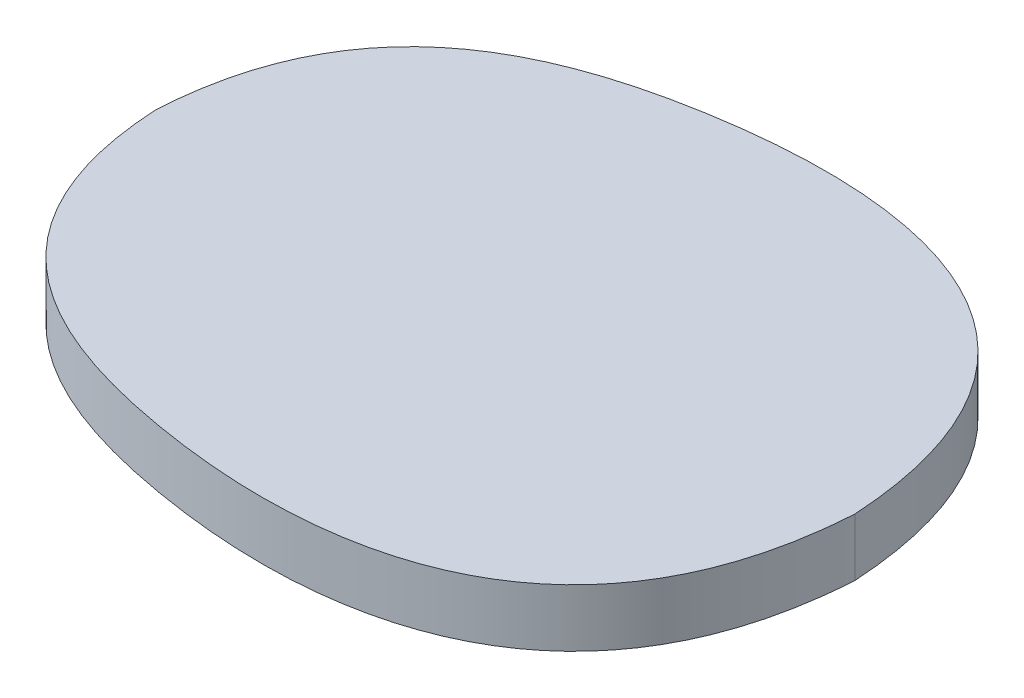
from build123d import *

# Parameters (mm, degrees)
EXTRUDE1_DEPTH = 10


with BuildPart() as part:
    # Sketch1 → Extrude1 (new body)
    with BuildSketch(Plane(origin=(0, 0, 0), x_dir=(1, 0, 0), z_dir=(0, 1, 0))):
        with BuildLine():
            add(Edge.make_bspline(
                [(-50.840600096, 0), (-49.075063493, 32.407138226), (2.474127828, 57.357768523), (67.70718957, 46.900743857), (70.527379374, 0)],
                knots=[0, 0, 0, 0, 0.418325647, 1, 1, 1, 1], degree=3))
            add(Edge.make_bspline(
                [(-50.840600096, 0), (-49.075063493, -32.407138226), (2.474127828, -57.357768523), (67.70718957, -46.900743857), (70.527379374, 0)],
                knots=[0, 0, 0, 0, 0.418325647, 1, 1, 1, 1], degree=3))
        make_face()
    extrude(amount=EXTRUDE1_DEPTH)


solid = part.part
